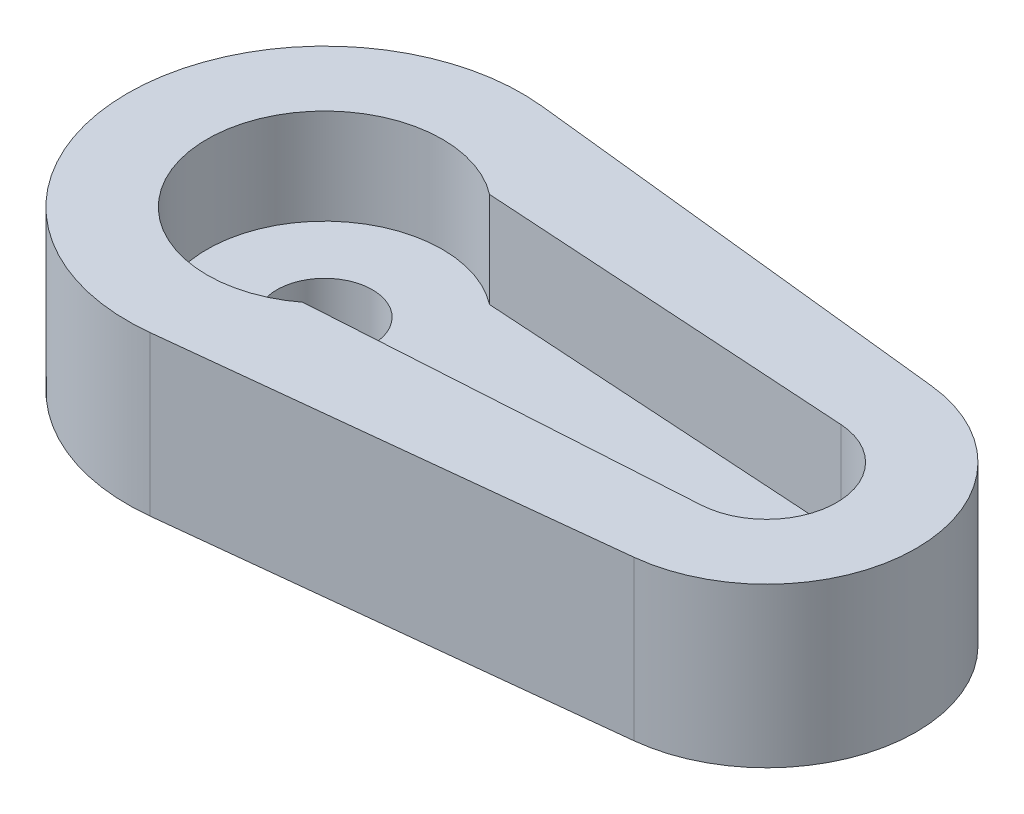
from build123d import *

# Parameters (mm, degrees)
SKETCH1_R           = 1.5
BOSS_EXTRUDE1_DEPTH = 2
BOSS_EXTRUDE2_DEPTH = 5


with BuildPart() as part:
    # Sketch1 → Boss-Extrude1 (new body)
    with BuildSketch(Plane(origin=(0, 0, 0), x_dir=(1, 0, 0), z_dir=(0, 1, 0))):
        with BuildLine():
            Line((14.03813079, 2.195659328), (2.25, 2.937260629))
            ThreePointArc((2.25, 2.937260629), (-3.7, 0), (2.25, -2.937260629))
            Line((2.25, -2.937260629), (14.03813079, -2.195659328))
            ThreePointArc((14.03813079, -2.195659328), (16.1, 0), (14.03813079, 2.195659328))
        make_face()
        Circle(SKETCH1_R, mode=Mode.SUBTRACT)
    extrude(amount=BOSS_EXTRUDE1_DEPTH)

    # Sketch1<3> → Boss-Extrude2 (add)
    with BuildSketch(Plane(origin=(0, 0, 0), x_dir=(1, 0, 0), z_dir=(0, 1, 0))):
        with BuildLine():
            Line((14.407194245, 4.672553263), (0.669064748, 6.163793666))
            ThreePointArc((0.669064748, 6.163793666), (-6.2, 0), (0.669064748, -6.163793666))
            Line((0.669064748, -6.163793666), (14.407194245, -4.672553263))
            ThreePointArc((14.407194245, -4.672553263), (18.6, 0), (14.407194245, 4.672553263))
        make_face()
        with BuildLine():
            ThreePointArc((2.25, -2.937260629), (-3.7, 0), (2.25, 2.937260629))
            Line((2.25, 2.937260629), (14.03813079, 2.195659328))
            ThreePointArc((14.03813079, 2.195659328), (16.1, 0), (14.03813079, -2.195659328))
            Line((14.03813079, -2.195659328), (2.25, -2.937260629))
        make_face(mode=Mode.SUBTRACT)
    extrude(amount=BOSS_EXTRUDE2_DEPTH)


solid = part.part
